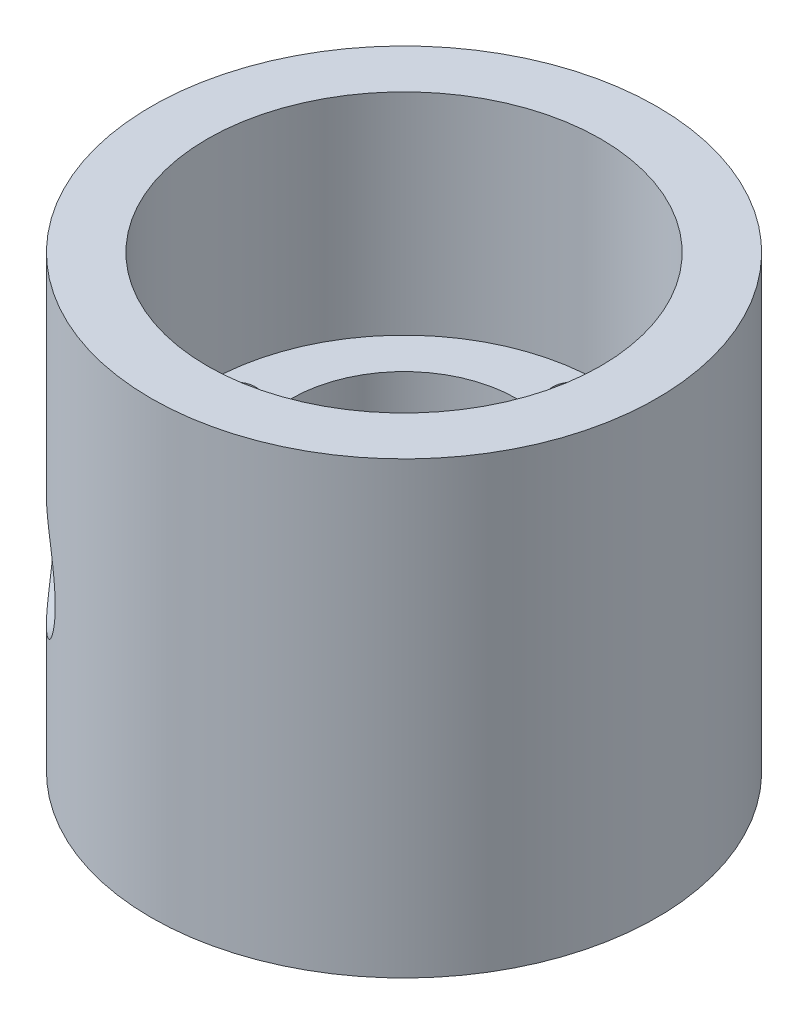
from build123d import *

# Parameters (mm, degrees)
SKETCH1_R             = 14.2875
BOSS_EXTRUDE1_DEPTH   = 25.4
SKETCH3_R             = 11.1125
CUT_EXTRUDE1_DEPTH    = 7.14375
CUT_EXTRUDE2_DEPTH    = 18.25625
CUT_EXTRUDE3_START    = -11.90625
SKETCH5_R             = 11.1125
CUT_EXTRUDE3_DEPTH    = 11.90625
F_4_40_TAPPED_HOLE1_D = 2.2606
CIRPATTERN1_COUNT     = 4
SKETCH8_R             = 3.1496
CUT_EXTRUDE6_DEPTH    = 33.456514177


with BuildPart() as part:
    # Sketch1 → Boss-Extrude1 (new body)
    with BuildSketch(Plane(origin=(0, 0, 0), x_dir=(1, 0, 0), z_dir=(0, 1, 0))):
        Circle(SKETCH1_R)
    extrude(amount=BOSS_EXTRUDE1_DEPTH)

    # Sketch3 → Cut-Extrude1 (cut)
    with BuildSketch(Plane.XZ):
        Circle(SKETCH3_R)
    extrude(amount=-CUT_EXTRUDE1_DEPTH, mode=Mode.SUBTRACT)

    # Sketch4 → Cut-Extrude2 (cut)
    with BuildSketch(Plane(origin=(0, 25.4, 0), x_dir=(1, 0, 0), z_dir=(0, 1, 0))):
        with BuildLine():
            Line((-1.5875, 7.9375), (1.5875, 7.9375))
            ThreePointArc((1.5875, 7.9375), (6.077628061, 6.077628061), (7.9375, 1.5875))
            Line((7.9375, 1.5875), (7.9375, -1.5875))
            ThreePointArc((7.9375, -1.5875), (6.077628061, -6.077628061), (1.5875, -7.9375))
            Line((1.5875, -7.9375), (-1.5875, -7.9375))
            ThreePointArc((-1.5875, -7.9375), (-6.077628061, -6.077628061), (-7.9375, -1.5875))
            Line((-7.9375, -1.5875), (-7.9375, 1.5875))
            ThreePointArc((-7.9375, 1.5875), (-6.077628061, 6.077628061), (-1.5875, 7.9375))
        make_face()
    extrude(amount=-CUT_EXTRUDE2_DEPTH, mode=Mode.SUBTRACT)

    # Sketch5 → Cut-Extrude3 (cut)
    with BuildSketch(Plane(origin=(0, 25.4, 0), x_dir=(1, 0, 0), z_dir=(0, 1, 0)).offset(CUT_EXTRUDE3_START)):
        Circle(SKETCH5_R)
    extrude(amount=CUT_EXTRUDE3_DEPTH, mode=Mode.SUBTRACT)

    # #4-40 Tapped Hole1 (through all)
    with Locations(Plane(origin=(0, 13.49375, 0), x_dir=(-1, 0, 0), z_dir=(0, 1, 0))):
        with Locations((0, -9.525)):
            f_4_40_tapped_hole1 = Hole(F_4_40_TAPPED_HOLE1_D / 2)

    # CirPattern1: #4-40 Tapped Hole1 ×4 about axis
    cirpattern1_axis = Axis((0, 25.4, 0), (0, 1, 0))
    for i in range(1, CIRPATTERN1_COUNT):
        add(f_4_40_tapped_hole1.rotate(cirpattern1_axis, i * 360 / CIRPATTERN1_COUNT), mode=Mode.SUBTRACT)

    # Sketch8 → Cut-Extrude6 (cut, through all)
    with BuildSketch(Plane(origin=(0, 0, 0), x_dir=(-0.7071067811865488, 0, -0.7071067811865464), z_dir=(0.7071067811865464, 0, -0.7071067811865488))):
        with Locations((0, 10.31875)):
            Circle(SKETCH8_R)
    extrude(amount=-CUT_EXTRUDE6_DEPTH, mode=Mode.SUBTRACT)


solid = part.part
